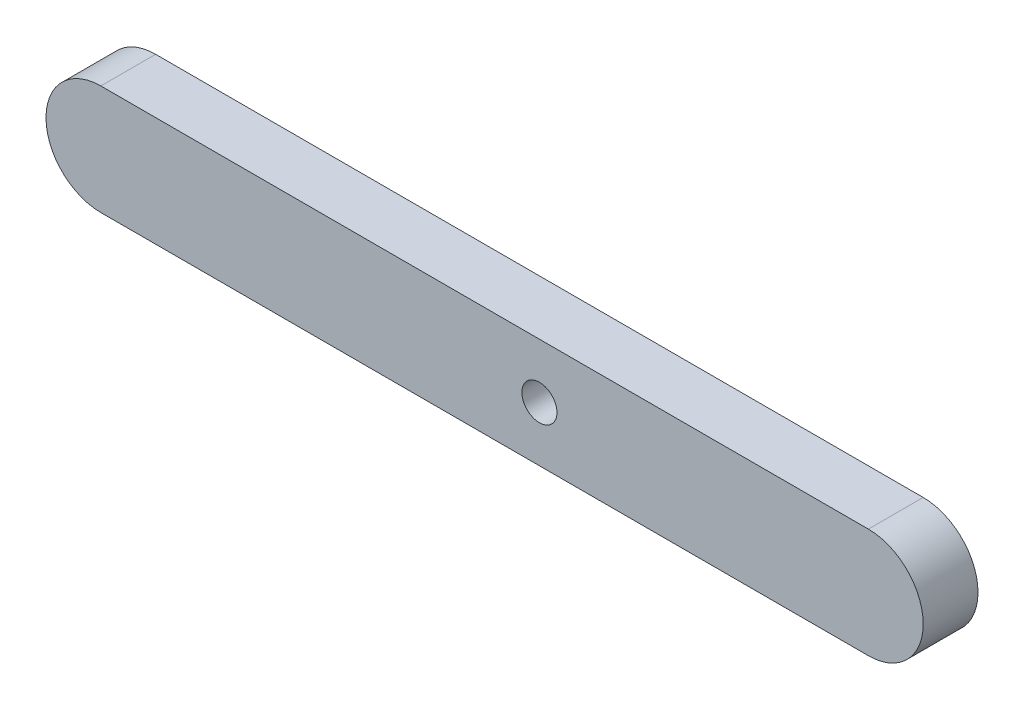
from build123d import *

# Parameters (mm, degrees)
SKETCH_1_R      = 1.6
EXTRUDE_1_DEPTH = 5


with BuildPart() as part:
    # 草图1 → 凸台-拉伸1 (new body)
    with BuildSketch(Plane.XY):
        with BuildLine():
            Line((0, 5), (70, 5))
            ThreePointArc((70, 5), (75, 0), (70, -5))
            Line((70, -5), (0, -5))
            ThreePointArc((0, -5), (-5, 0), (0, 5))
        make_face()
        with Locations((40, 0)):
            Circle(SKETCH_1_R, mode=Mode.SUBTRACT)
    extrude(amount=EXTRUDE_1_DEPTH)


solid = part.part
